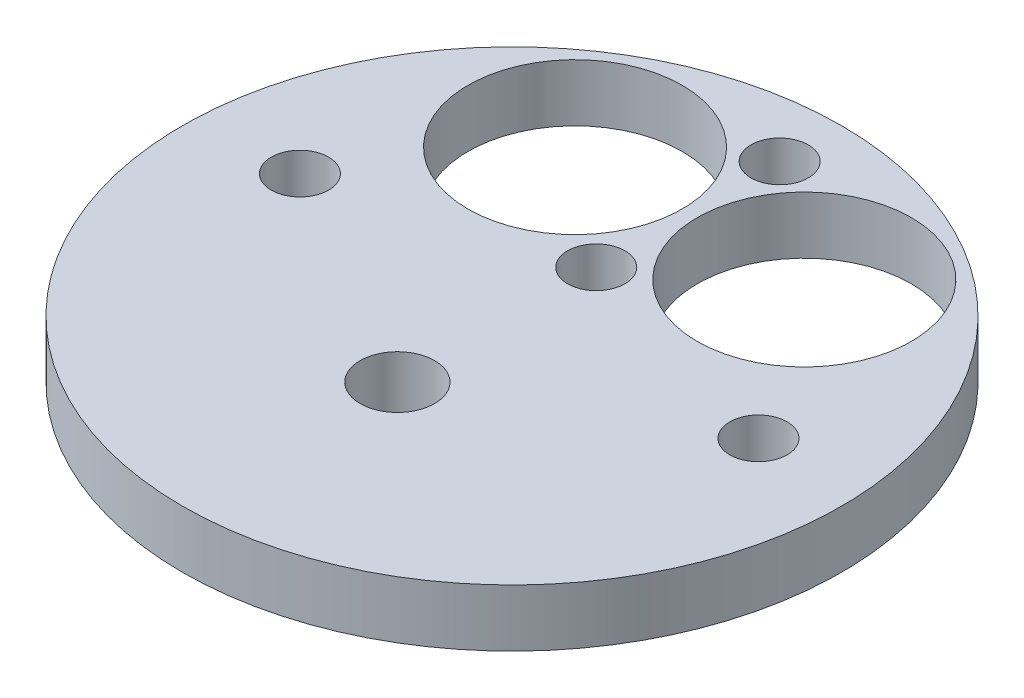
from build123d import *

# Parameters (mm, degrees)
SKETCH1_R           = 36.5125
BOSS_EXTRUDE1_DEPTH = 6.35
SKETCH19_R          = 11.8745
SKETCH19_R_2        = 3.175
CUT_EXTRUDE1_DEPTH  = 16.764
SKETCH18_R          = 3.175
CUT_EXTRUDE2_DEPTH  = 16.764
SKETCH21_R          = 4.1275
CUT_EXTRUDE3_DEPTH  = 53.025453506


with BuildPart() as part:
    # Sketch1 → Boss-Extrude1 (new body)
    with BuildSketch(Plane(origin=(0, 0, 0), x_dir=(1, 0, 0), z_dir=(0, 1, 0))):
        Circle(SKETCH1_R)
    extrude(amount=BOSS_EXTRUDE1_DEPTH)

    # Sketch19 → Cut-Extrude1 (cut)
    with BuildSketch(Plane(origin=(0, 6.35, 0), x_dir=(1, 0, 0), z_dir=(0, 1, 0))):
        with Locations((-12.7, 19.685)):
            Circle(SKETCH19_R)
        with Locations((12.7, 19.685)):
            Circle(SKETCH19_R)
        with Locations((0, 29.654011512)):
            Circle(SKETCH19_R_2)
        with Locations((0, 9.334011512)):
            Circle(SKETCH19_R_2)
    extrude(amount=-CUT_EXTRUDE1_DEPTH, mode=Mode.SUBTRACT)

    # Sketch18 → Cut-Extrude2 (cut)
    with BuildSketch(Plane(origin=(0, 6.35, 0), x_dir=(1, 0, 0), z_dir=(0, 1, 0))):
        with Locations((25.4, 1.905)):
            Circle(SKETCH18_R)
        with Locations((-25.4, 1.905)):
            Circle(SKETCH18_R)
    extrude(amount=-CUT_EXTRUDE2_DEPTH, mode=Mode.SUBTRACT)

    # Sketch21 → Cut-Extrude3 (cut, through all)
    with BuildSketch(Plane(origin=(0, 6.35, 0), x_dir=(1, 0, 0), z_dir=(0, 1, 0))):
        with Locations((0, -12.7)):
            Circle(SKETCH21_R)
    extrude(amount=-CUT_EXTRUDE3_DEPTH, mode=Mode.SUBTRACT)


solid = part.part
